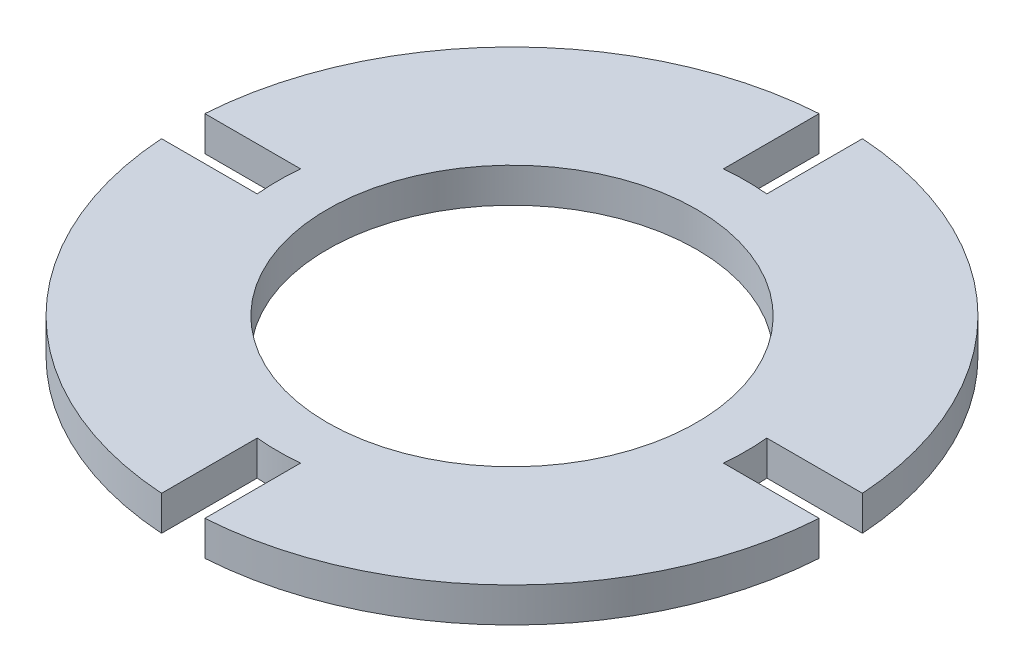
from build123d import *

# Parameters (mm, degrees)
BOSS_EXTRUDE1_DEPTH = 5.08
SKETCH2_R           = 27.051
CUT_EXTRUDE1_DEPTH  = 69.29129044


with BuildPart() as part:
    # Sketch1 → Boss-Extrude1 (new body)
    with BuildSketch(Plane(origin=(0, 0, 0), x_dir=(1, 0, 0), z_dir=(0, 1, 0))):
        with BuildLine():
            ThreePointArc((34.142692849, -3.175), (34.29, 0), (34.142692849, 3.175))
            Line((34.142692849, 3.175), (48.155445954, 3.175))
            ThreePointArc((48.155445954, 3.175), (34.12497326, 34.12497326), (3.175, 48.155445954))
            Line((3.175, 48.155445954), (3.175, 34.142692849))
            ThreePointArc((3.175, 34.142692849), (0, 34.29), (-3.175, 34.142692849))
            Line((-3.175, 34.142692849), (-3.175, 48.155445954))
            ThreePointArc((-3.175, 48.155445954), (-34.12497326, 34.12497326), (-48.155445954, 3.175))
            Line((-48.155445954, 3.175), (-34.142692849, 3.175))
            ThreePointArc((-34.142692849, 3.175), (-34.29, 0), (-34.142692849, -3.175))
            Line((-34.142692849, -3.175), (-48.155445954, -3.175))
            ThreePointArc((-48.155445954, -3.175), (-34.12497326, -34.12497326), (-3.175, -48.155445954))
            Line((-3.175, -48.155445954), (-3.175, -34.142692849))
            ThreePointArc((-3.175, -34.142692849), (0, -34.29), (3.175, -34.142692849))
            Line((3.175, -34.142692849), (3.175, -48.155445954))
            ThreePointArc((3.175, -48.155445954), (34.12497326, -34.12497326), (48.155445954, -3.175))
            Line((48.155445954, -3.175), (34.142692849, -3.175))
        make_face()
    extrude(amount=BOSS_EXTRUDE1_DEPTH)

    # Sketch2 → Cut-Extrude1 (cut, through all)
    with BuildSketch(Plane(origin=(0, 5.08, 0), x_dir=(1, 0, 0), z_dir=(0, 1, 0))):
        with Locations(Location((0, 0, 0), (0, 0, 270))):
            Circle(SKETCH2_R)
    extrude(amount=-CUT_EXTRUDE1_DEPTH, mode=Mode.SUBTRACT)


solid = part.part
